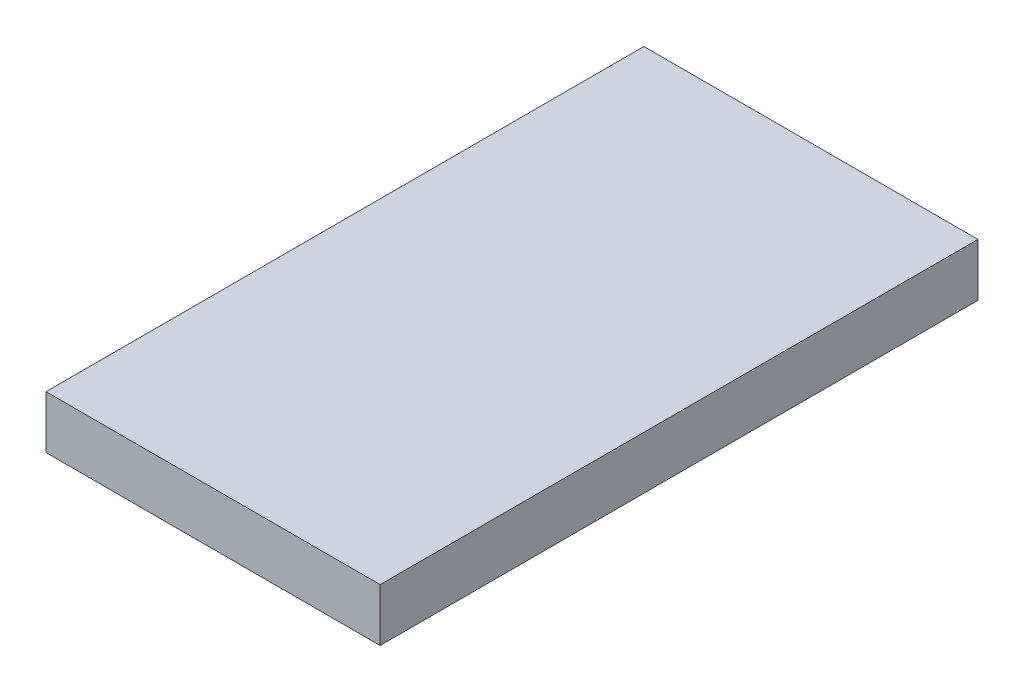
from build123d import *

# Parameters (mm, degrees)
SKETCH1_W          = 120.65
SKETCH1_H          = 215.9
BASE_EXTRUDE_DEPTH = 19.05


with BuildPart() as part:
    # Sketch1 → Base Extrude (new body)
    with BuildSketch(Plane(origin=(0, 0, 0), x_dir=(1, 0, 0), z_dir=(0, 1, 0))):
        with Locations((60.325, 107.95)):
            Rectangle(SKETCH1_W, SKETCH1_H)
    extrude(amount=BASE_EXTRUDE_DEPTH)


solid = part.part
